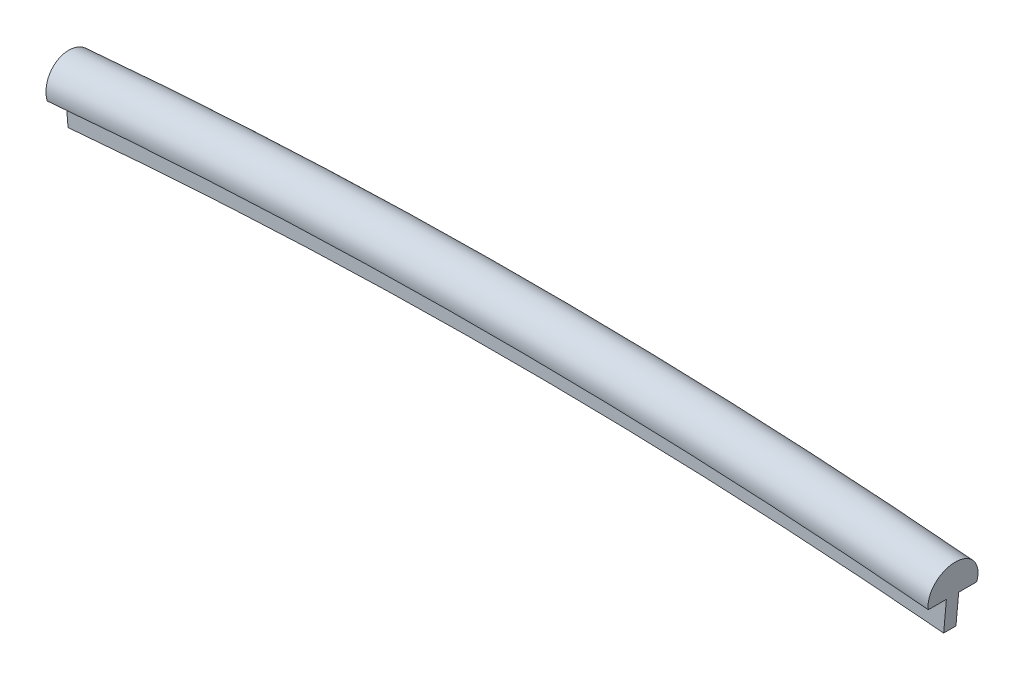
from build123d import *

# Parameters (mm, degrees)
REVOLVE1_ANGLE           = 5.11459649
REVOLVE1_OTHER_WAY_ANGLE = 5.11459649


with BuildPart() as part:
    # Sketch2 → Revolve1 (revolve)
    with BuildSketch(Plane(origin=(0, 0, 0), x_dir=(0, 0, -1), z_dir=(1, 0, 0))):
        with BuildLine():
            Line((0, 239.8), (0.3, 239.8))
            Line((0.3, 239.8), (0.3, 241.3))
            Line((0.3, 241.3), (1.18, 241.3))
            ThreePointArc((1.18, 241.3), (0, 242.800182019), (-1.18, 241.3))
            Line((-1.18, 241.3), (-0.3, 241.3))
            Line((-0.3, 241.3), (-0.3, 239.8))
            Line((-0.3, 239.8), (0, 239.8))
        make_face()
    revolve(axis=Axis((0, 0, 70.597641597), (0, 0, -1)), revolution_arc=REVOLVE1_ANGLE)

    # Sketch2 → Revolve1 other way (revolve)
    with BuildSketch(Plane(origin=(0, 0, 0), x_dir=(0, 0, -1), z_dir=(1, 0, 0))):
        with BuildLine():
            Line((0, 239.8), (0.3, 239.8))
            Line((0.3, 239.8), (0.3, 241.3))
            Line((0.3, 241.3), (1.18, 241.3))
            ThreePointArc((1.18, 241.3), (0, 242.800182019), (-1.18, 241.3))
            Line((-1.18, 241.3), (-0.3, 241.3))
            Line((-0.3, 241.3), (-0.3, 239.8))
            Line((-0.3, 239.8), (0, 239.8))
        make_face()
    revolve(axis=Axis((0, 0, 70.597641597), (0, 0, 1)), revolution_arc=REVOLVE1_OTHER_WAY_ANGLE)


solid = part.part
